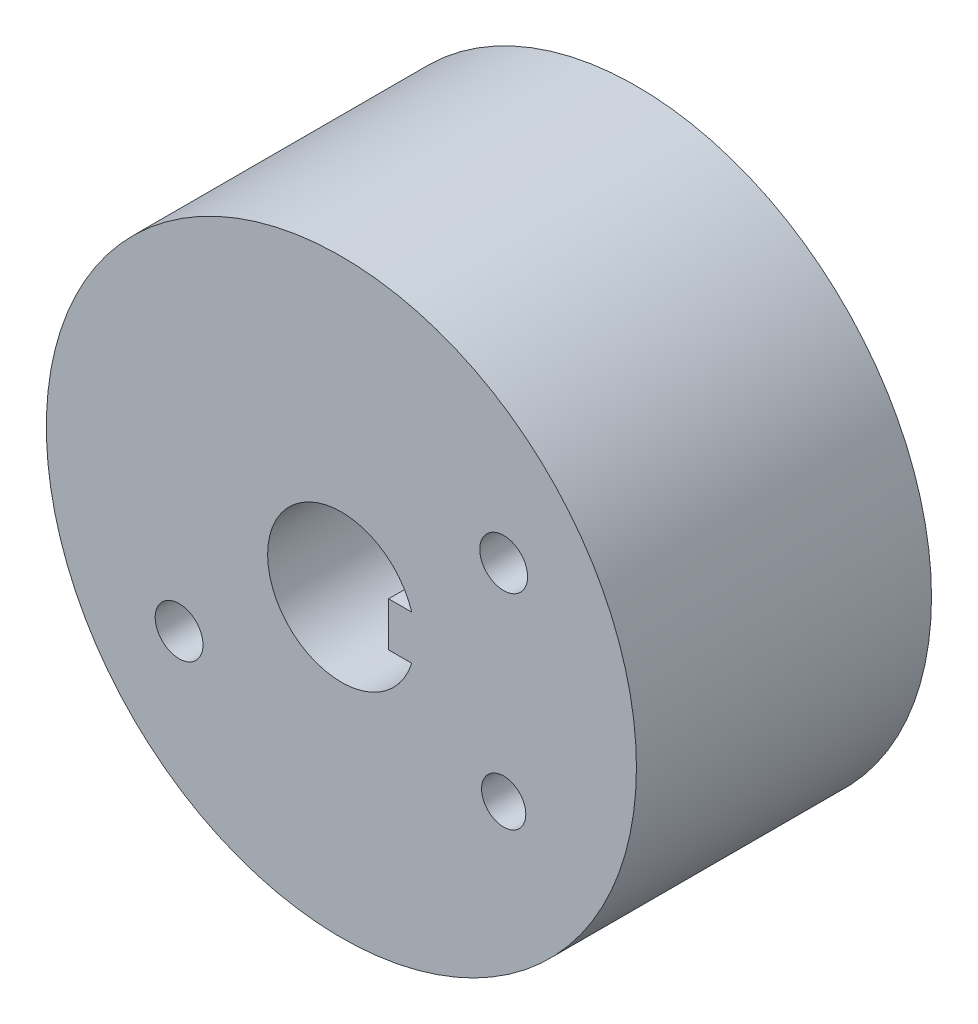
from build123d import *

# Parameters (mm, degrees)
SKETCH_1_R          = 20
EXTRUDE_1_DEPTH     = 20
CUT_EXTRUDE_1_DEPTH = 22.5
SKETCH_3_R          = 1.62
SKETCH_3_R_2        = 1.5
CUT_EXTRUDE_2_DEPTH = 22.5


with BuildPart() as part:
    # 草图1 → 凸台-拉伸1 (new body)
    with BuildSketch(Plane.XY):
        Circle(SKETCH_1_R)
    extrude(amount=EXTRUDE_1_DEPTH)

    # 草图2 → 切除-拉伸1 (cut)
    with BuildSketch(Plane.XY.offset(20)):
        with BuildLine():
            Line((4.769696007, -1.5), (3.2, -1.5))
            Line((3.2, -1.5), (3.2, 1.5))
            Line((3.2, 1.5), (4.769696007, 1.5))
            ThreePointArc((4.769696007, 1.5), (-5, 0), (4.769696007, -1.5))
        make_face()
    extrude(amount=-CUT_EXTRUDE_1_DEPTH, mode=Mode.SUBTRACT)

    # 草图3 → 切除-拉伸2 (cut)
    with BuildSketch(Plane.XY.offset(20)):
        with Locations((11, 7.5)):
            Circle(SKETCH_3_R)
        with Locations((-11, -7.5)):
            Circle(SKETCH_3_R)
        with Locations((11, -6.5)):
            Circle(SKETCH_3_R_2)
    extrude(amount=-CUT_EXTRUDE_2_DEPTH, mode=Mode.SUBTRACT)


solid = part.part
